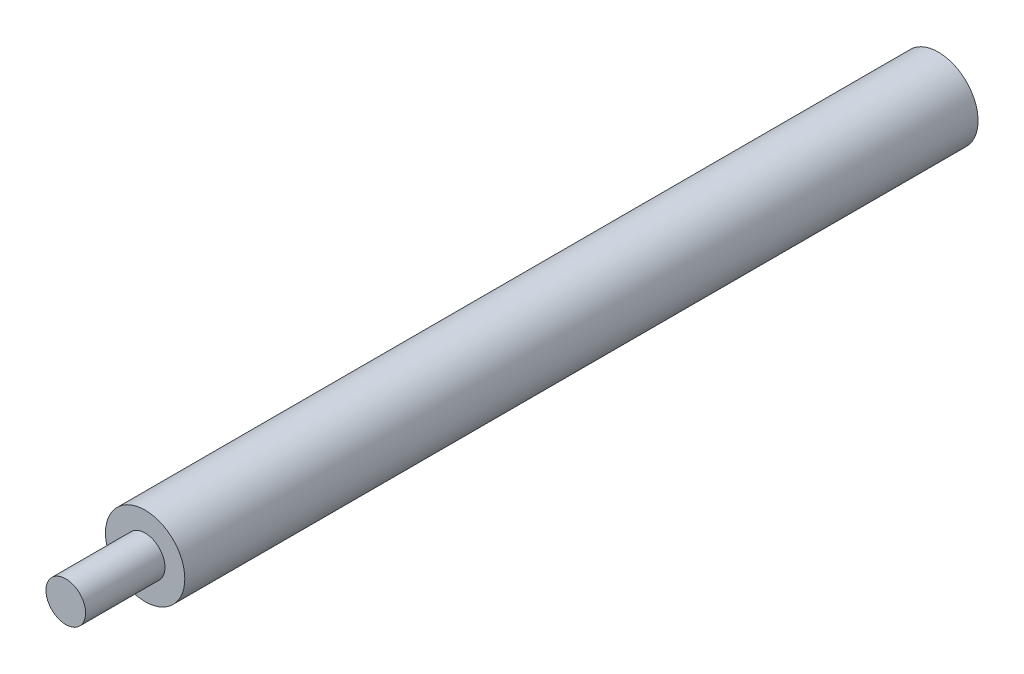
from build123d import *

# Parameters (mm, degrees)
SKETCH1_R           = 2.5
BOSS_EXTRUDE1_DEPTH = 60
SKETCH2_R           = 1.25
BOSS_EXTRUDE2_DEPTH = 5
SKETCH3_R           = 1.25
CUT_EXTRUDE1_DEPTH  = 5
SKETCH4_R           = 2.619839841
CUT_EXTRUDE2_DEPTH  = 10
SKETCH5_R           = 1.25
CUT_EXTRUDE3_DEPTH  = 5


with BuildPart() as part:
    # Sketch1 → Boss-Extrude1 (new body)
    with BuildSketch(Plane.XY):
        Circle(SKETCH1_R)
    extrude(amount=BOSS_EXTRUDE1_DEPTH)

    # Sketch2 → Boss-Extrude2 (add)
    with BuildSketch(Plane.XY.offset(60)):
        Circle(SKETCH2_R)
    extrude(amount=BOSS_EXTRUDE2_DEPTH)

    # Sketch3 → Cut-Extrude1 (cut)
    with BuildSketch(Plane(origin=(0, 0, 0), x_dir=(-1, 0, 0), z_dir=(0, 0, -1))):
        with Locations(Location((0, 0, 0), (0, 0, 180))):
            Circle(SKETCH3_R)
    extrude(amount=-CUT_EXTRUDE1_DEPTH, mode=Mode.SUBTRACT)

    # Sketch4 → Cut-Extrude2 (cut)
    with BuildSketch(Plane(origin=(0, 0, 0), x_dir=(-1, 0, 0), z_dir=(0, 0, -1))):
        Circle(SKETCH4_R)
    extrude(amount=-CUT_EXTRUDE2_DEPTH, mode=Mode.SUBTRACT)

    # Sketch5 → Cut-Extrude3 (cut)
    with BuildSketch(Plane(origin=(0, 0, 10), x_dir=(-1, 0, 0), z_dir=(0, 0, -1))):
        with Locations(Location((0, 0, 0), (0, 0, 180))):
            Circle(SKETCH5_R)
    extrude(amount=-CUT_EXTRUDE3_DEPTH, mode=Mode.SUBTRACT)


solid = part.part
